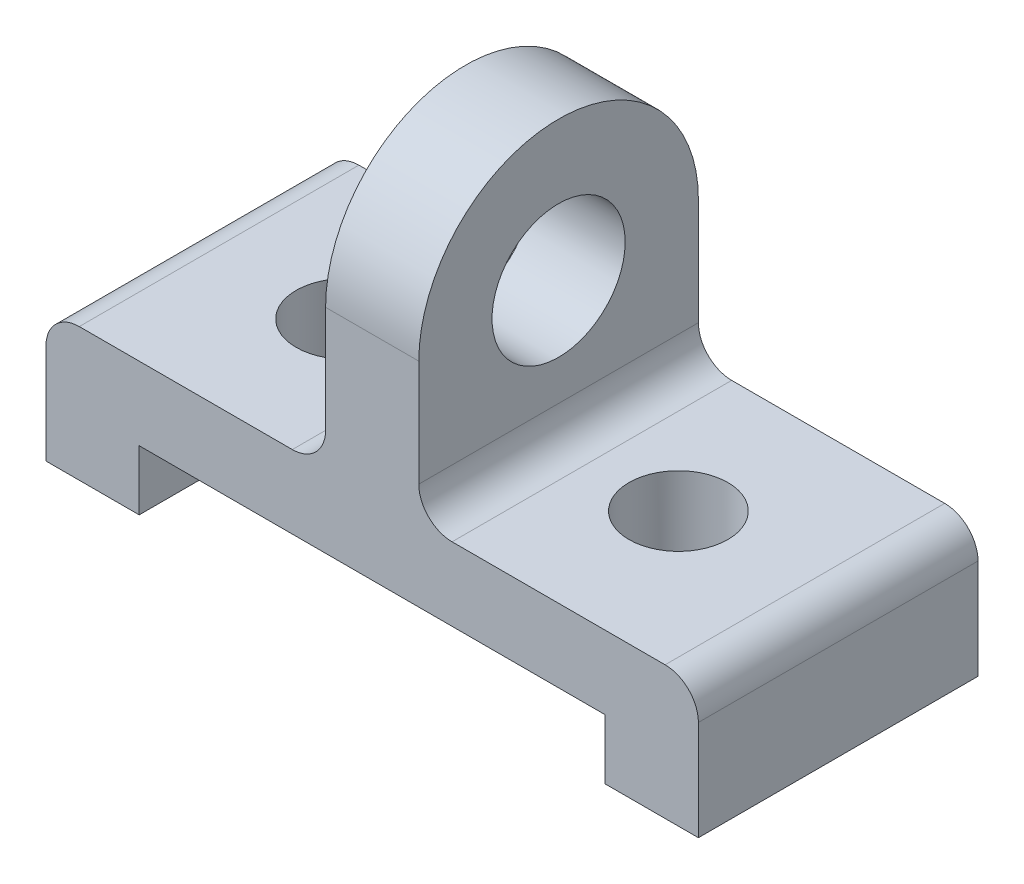
from build123d import *

# Parameters (mm, degrees)
SKETCH1_W           = 98
SKETCH1_H           = 42
BOSS_EXTRUDE1_DEPTH = 20
SKETCH2_W           = 70
SKETCH2_H           = 9
CUT_EXTRUDE1_DEPTH  = 68.564783726
SKETCH3_W           = 42
SKETCH3_H           = 42
BOSS_EXTRUDE2_DEPTH = 7
FILLET1_RADIUS      = 21
FILLET1_LENGTH      = 14
SKETCH4_R           = 10
CUT_EXTRUDE2_DEPTH  = 87.145226217
SKETCH5_R           = 7.424250223
CUT_EXTRUDE5_DEPTH  = 68.867518004
FILLET2_R           = 5


with BuildPart() as part:
    # Sketch1 → Boss-Extrude1 (new body)
    with BuildSketch(Plane(origin=(0, 0, 0), x_dir=(1, 0, 0), z_dir=(0, 1, 0))):
        Rectangle(SKETCH1_W, SKETCH1_H)
    extrude(amount=BOSS_EXTRUDE1_DEPTH)

    # Sketch2 → Cut-Extrude1 (cut, through all)
    with BuildSketch(Plane.XY.offset(21)):
        with Locations((0, 4.5)):
            Rectangle(SKETCH2_W, SKETCH2_H)
    extrude(amount=-CUT_EXTRUDE1_DEPTH, mode=Mode.SUBTRACT)

    # Sketch3 → Boss-Extrude2 (add, symmetric)
    with BuildSketch(Plane(origin=(0, 0, 0), x_dir=(0, 0, -1), z_dir=(1, 0, 0))):
        with Locations((0, 41)):
            Rectangle(SKETCH3_W, SKETCH3_H)
    extrude(amount=BOSS_EXTRUDE2_DEPTH, both=True)

    # Fillet1: full round fillet: the end face becomes a half cylinder, R = half its width
    fillet1_face = Plane((0, 62, 0), x_dir=(1, 0, 0), z_dir=(0, 1, 0))  # on the end face: x along it, z out of the body
    fillet1_slab = fillet1_face.offset(-FILLET1_RADIUS / 2) * Box(FILLET1_LENGTH, 2 * FILLET1_RADIUS, FILLET1_RADIUS, mode=Mode.PRIVATE)  # the body's end, R deep
    fillet1_round = Plane((0, 41, 0), x_dir=(0, 1, 0), z_dir=(1, 0, 0)) * Cylinder(FILLET1_RADIUS, FILLET1_LENGTH, mode=Mode.PRIVATE)  # its axis R under the face
    add(fillet1_slab - fillet1_round, mode=Mode.SUBTRACT)

    # Sketch4 → Cut-Extrude2 (cut, through all)
    with BuildSketch(Plane(origin=(7, 0, 0), x_dir=(0, 0, -1), z_dir=(1, 0, 0))):
        with Locations((0, 41)):
            Circle(SKETCH4_R)
    extrude(amount=-CUT_EXTRUDE2_DEPTH, mode=Mode.SUBTRACT)

    # Sketch5 → Cut-Extrude5 (cut, through all)
    with BuildSketch(Plane(origin=(0, 20, 0), x_dir=(1, 0, 0), z_dir=(0, 1, 0))):
        with Locations(Location((-25, 0, 0), (0, 0, 270))):
            Circle(SKETCH5_R)
        with Locations(Location((25, 0, 0), (0, 0, 270))):
            Circle(SKETCH5_R)
    extrude(amount=-CUT_EXTRUDE5_DEPTH, mode=Mode.SUBTRACT)

    # Fillet2
    fillet2_edges = [part.edges().sort_by_distance(p)[0] for p in [
        (-49, 20, 0),
        (-7, 20, 0),
        (7, 20, 0),
        (49, 20, 0),
    ]]
    fillet(fillet2_edges, radius=FILLET2_R)


solid = part.part
